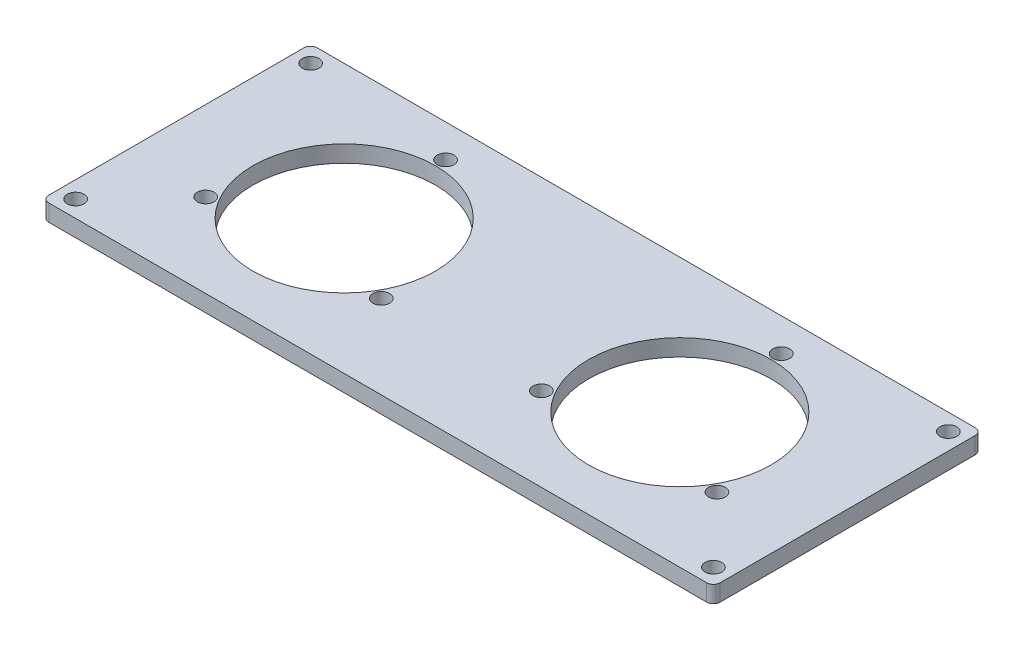
from build123d import *

# Parameters (mm, degrees)
SKETCH1_W            = 127
SKETCH1_H            = 101.6
SKETCH1_R            = 34.544
SKETCH1_R_2          = 3.175
BOSS_EXTRUDE1_DEPTH  = 6.35
FILLET1_R            = 2.54
FILLET1_OF_MIRROR1_R = 2.54


with BuildPart() as part:
    # Sketch1 → Boss-Extrude1 (new body)
    with BuildSketch(Plane(origin=(0, 0, 0), x_dir=(1, 0, 0), z_dir=(0, 1, 0))):
        with Locations((63.5, 50.8)):
            Rectangle(SKETCH1_W, SKETCH1_H)
        with Locations(Location((63.5, 50.8, 0), (0, 0, 270))):
            Circle(SKETCH1_R, mode=Mode.SUBTRACT)
        with Locations(Location((6.35, 95.25, 0), (0, 0, 270))):
            Circle(SKETCH1_R_2, mode=Mode.SUBTRACT)
        with Locations(Location((6.35, 6.35, 0), (0, 0, 270))):
            Circle(SKETCH1_R_2, mode=Mode.SUBTRACT)
        with Locations(Location((63.5, 89.154, 0), (0, 0, 270))):
            Circle(SKETCH1_R_2, mode=Mode.SUBTRACT)
        with Locations(Location((96.715538337, 31.623, 0), (0, 0, 270))):
            Circle(SKETCH1_R_2, mode=Mode.SUBTRACT)
        with Locations(Location((30.284461663, 31.623, 0), (0, 0, 270))):
            Circle(SKETCH1_R_2, mode=Mode.SUBTRACT)
    boss_extrude1 = extrude(amount=BOSS_EXTRUDE1_DEPTH)

    # Fillet1
    fillet1_edges = [part.edges().sort_by_distance(p)[0] for p in [
        (0, 3.175, -101.6),
        (0, 3.175, 0),
    ]]
    fillet(fillet1_edges, radius=FILLET1_R)

    # Mirror1: Boss-Extrude1 across plane
    add(boss_extrude1.mirror(Plane(origin=(127, 6.35, 0), x_dir=(0, 0, 1), z_dir=(-1, 0, 0))))

    # Fillet1 of Mirror1
    fillet1_of_mirror1_edges = [part.edges().sort_by_distance(p)[0] for p in [
        (254, 3.175, -101.6),
        (254, 3.175, 0),
    ]]
    fillet(fillet1_of_mirror1_edges, radius=FILLET1_OF_MIRROR1_R)


solid = part.part
